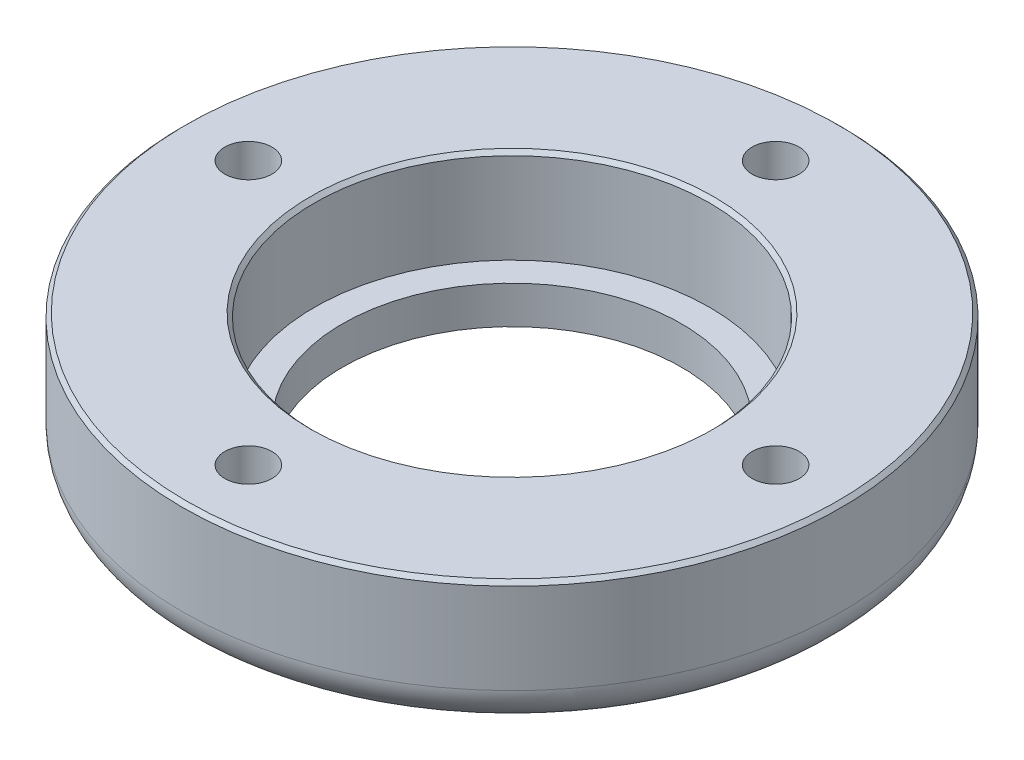
from build123d import *

# Parameters (mm, degrees)
TROU_TARAUD_M31_D            = 2.5
R_P_TITION_CIRCULAIRE1_COUNT = 4
CHANFREIN1_SIZE              = 0.2
CONG_1_R                     = 2


with BuildPart() as part:
    # Esquisse1 → Révolution1 (revolve)
    with BuildSketch(Plane(origin=(0, 0, 0), x_dir=(0, 0, -1), z_dir=(1, 0, 0))):
        Polygon((-9, -2), (-9, 0), (-10.5, 0), (-10.5, 5), (-17.5, 5), (-17.5, -2), align=None)
    revolve(axis=Axis((0, 0, 0), (0, -1, 0)))

    # Trou taraudé M31 (through all)
    with Locations(Plane(origin=(0, 5, 0), x_dir=(-1, 0, 0), z_dir=(0, 1, 0))):
        with Locations((0, -14)):
            trou_taraud_m31 = Hole(TROU_TARAUD_M31_D / 2)

    # Répétition circulaire1: Trou taraudé M31 ×4 about axis
    r_p_tition_circulaire1_axis = Axis((0, 0, 0), (0, 1, 0))
    for i in range(1, R_P_TITION_CIRCULAIRE1_COUNT):
        add(trou_taraud_m31.rotate(r_p_tition_circulaire1_axis, i * 360 / R_P_TITION_CIRCULAIRE1_COUNT), mode=Mode.SUBTRACT)

    # Chanfrein1
    chanfrein1_edges = [part.edges().sort_by_distance(p)[0] for p in [
        (0, 5, -17.5),
        (0, 5, -10.5),
    ]]
    chamfer(chanfrein1_edges, length=CHANFREIN1_SIZE)

    # Congé1
    cong_1_edges = [part.edges().sort_by_distance(p)[0] for p in [
        (0, -2, -17.5),
    ]]
    fillet(cong_1_edges, radius=CONG_1_R)


solid = part.part
